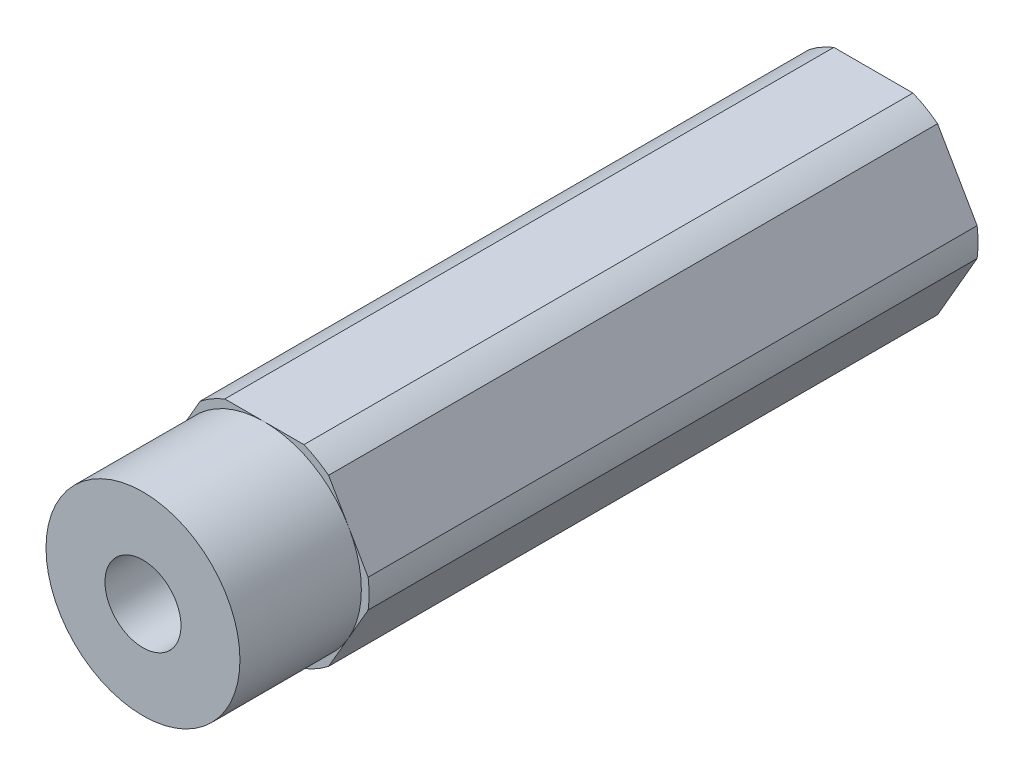
from build123d import *

# Parameters (mm, degrees)
BOSS_EXTRUDE1_DEPTH = 23.9141
SKETCH3_OUTSIDE_W   = 26.986
SKETCH3_OUTSIDE_H   = 25.022
SKETCH3_OUTSIDE_R   = 6.35
CUT_EXTRUDE2_DEPTH  = 7.9502
SKETCH4_OUTSIDE_W   = 26.986
SKETCH4_OUTSIDE_H   = 25.022
SKETCH4_OUTSIDE_R   = 6.858
CUT_EXTRUDE3_DEPTH  = 49.801870339
SKETCH5_R           = 2.4892
CUT_EXTRUDE4_DEPTH  = 49.732857286


with BuildPart() as part:
    # Sketch1 → Boss-Extrude1 (new, symmetric)
    with BuildSketch(Plane.XY):
        Polygon((7.332348419, 0), (3.666174209, 6.35), (-3.666174209, 6.35), (-7.332348419, 0), (-3.666174209, -6.35), (3.666174209, -6.35), align=None)
    extrude(amount=BOSS_EXTRUDE1_DEPTH, both=True)

    # Sketch3 outside → Cut-Extrude2 (cut)
    with BuildSketch(Plane.XY.offset(23.9141)):
        Rectangle(SKETCH3_OUTSIDE_W, SKETCH3_OUTSIDE_H)
        Circle(SKETCH3_OUTSIDE_R, mode=Mode.SUBTRACT)
    extrude(amount=-CUT_EXTRUDE2_DEPTH, mode=Mode.SUBTRACT)

    # Sketch4 outside → Cut-Extrude3 (cut, through all)
    with BuildSketch(Plane.XY.offset(23.9141)):
        Rectangle(SKETCH4_OUTSIDE_W, SKETCH4_OUTSIDE_H)
        Circle(SKETCH4_OUTSIDE_R, mode=Mode.SUBTRACT)
    extrude(amount=-CUT_EXTRUDE3_DEPTH, mode=Mode.SUBTRACT)

    # Sketch5 → Cut-Extrude4 (cut, through all)
    with BuildSketch(Plane.XY.offset(23.9141)):
        Circle(SKETCH5_R)
    extrude(amount=-CUT_EXTRUDE4_DEPTH, mode=Mode.SUBTRACT)


solid = part.part
